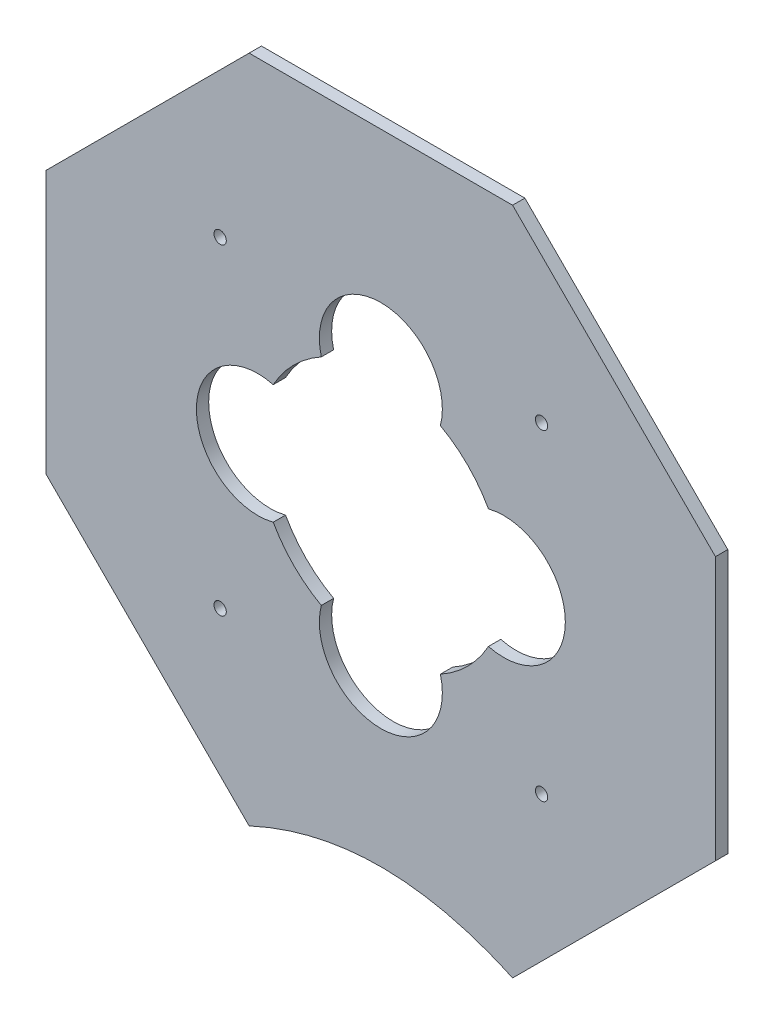
from build123d import *

# Parameters (mm, degrees)
BOSS_EXTRUDE1_DEPTH = 3
SKETCH2_R           = 1.5
CUT_EXTRUDE1_DEPTH  = 3
SKETCH3_R           = 30
SKETCH3_R_2         = 15
CUT_EXTRUDE2_DEPTH  = 3


with BuildPart() as part:
    # Sketch1 → Boss-Extrude1 (new body)
    with BuildSketch(Plane.XY):
        with BuildLine():
            Line((-32.133468612, 81.630943295), (32.133468612, 81.630943295))
            Line((32.133468612, 81.630943295), (81.630943295, 32.133468612))
            Line((81.630943295, 32.133468612), (81.630943295, -32.133468612))
            Line((81.630943295, -32.133468612), (32.133468612, -81.630943295))
            add(Edge.make_bspline(
                [(-32.133468612, -81.630943295), (-26.315604905, -78.929469601), (-17.458466972, -75.90692924), (-6.459846686, -74.366971031), (0.503945588, -74.095540146), (13.381410653, -74.737409183), (24.194527132, -77.919288079), (32.133468612, -81.630943295)],
                knots=[0, 0, 0, 0, 0.289771888, 0.418866631, 0.500125988, 0.604148798, 1, 1, 1, 1], degree=3))
            Line((-32.133468612, -81.630943295), (-81.630943295, -32.133468612))
            Line((-81.630943295, -32.133468612), (-81.630943295, 32.133468612))
            Line((-81.630943295, 32.133468612), (-32.133468612, 81.630943295))
        make_face()
    extrude(amount=BOSS_EXTRUDE1_DEPTH)

    # Sketch2 → Cut-Extrude1 (cut)
    with BuildSketch(Plane.XY.offset(3)):
        with Locations((-39.204536424, -39.204536424)):
            Circle(SKETCH2_R)
        with Locations((39.204536424, -39.204536424)):
            Circle(SKETCH2_R)
        with Locations((39.204536424, 39.204536424)):
            Circle(SKETCH2_R)
        with Locations((-39.204536424, 39.204536424)):
            Circle(SKETCH2_R)
    extrude(amount=-CUT_EXTRUDE1_DEPTH, mode=Mode.SUBTRACT)

    # Sketch3 → Cut-Extrude2 (cut)
    with BuildSketch(Plane.XY.offset(3)):
        Circle(SKETCH3_R)
        with Locations((0, 30)):
            Circle(SKETCH3_R_2)
        with Locations((0, -30)):
            Circle(SKETCH3_R_2)
        with Locations((30, 0)):
            Circle(SKETCH3_R_2)
        with Locations((-30, 0)):
            Circle(SKETCH3_R_2)
    extrude(amount=-CUT_EXTRUDE2_DEPTH, mode=Mode.SUBTRACT)


solid = part.part
